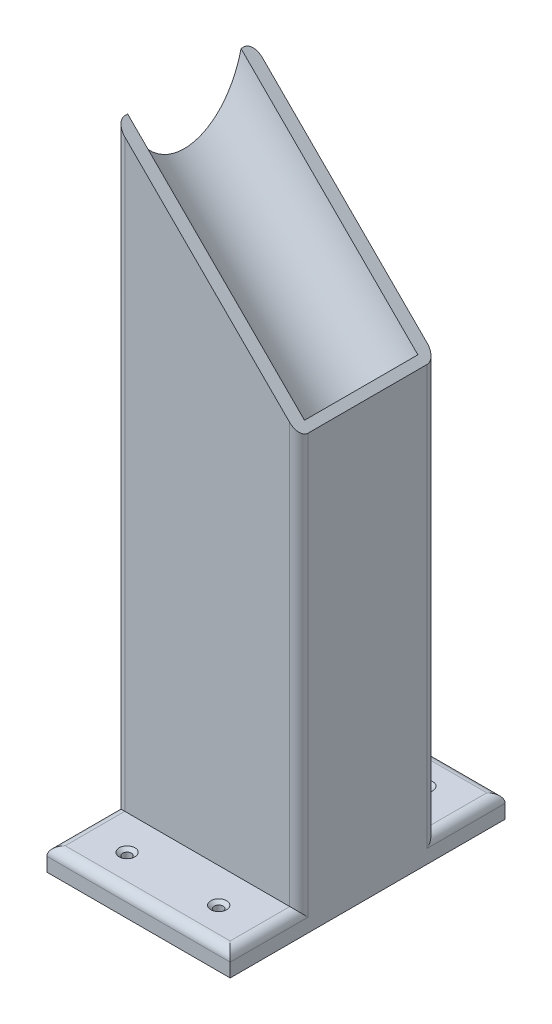
from build123d import *

# Parameters (mm, degrees)
SKETCH1_W                                         = 50.8
SKETCH1_H                                         = 76.2
BOSS_EXTRUDE1_DEPTH                               = 6.35
SKETCH2_W                                         = 50.8
SKETCH2_H                                         = 38.1
BOSS_EXTRUDE2_DEPTH                               = 171.6066
CUT_EXTRUDE1_DEPTH                                = 183.535025619
CUT_EXTRUDE1_DEPTH_BACK                           = 183.535025619
BOSS_EXTRUDE3_REACH                               = 237.296
SKETCH20_W                                        = 38.1
SKETCH20_H                                        = 2.54
BOSS_EXTRUDE4_REACH                               = 129.523
CSK_FOR_2_FLAT_HEAD_MACHINE_SCREW_100_D           = 2.4384
CSK_FOR_2_FLAT_HEAD_MACHINE_SCREW_100_CSINK_D     = 4.3688
CSK_FOR_2_FLAT_HEAD_MACHINE_SCREW_100_CSINK_ANGLE = 100
FILLET1_R                                         = 2.54
FILLET2_R                                         = 2.54


with BuildPart() as part:
    # Sketch1 → Boss-Extrude1 (new body)
    with BuildSketch(Plane(origin=(0, 0, 0), x_dir=(1, 0, 0), z_dir=(0, 1, 0))):
        with Locations((-132.195454545, 0)):
            Rectangle(SKETCH1_W, SKETCH1_H)
    extrude(amount=BOSS_EXTRUDE1_DEPTH)

    # Sketch2 → Boss-Extrude2 (add)
    with BuildSketch(Plane(origin=(0, 6.35, 0), x_dir=(1, 0, 0), z_dir=(0, 1, 0))):
        with Locations((-132.195454545, 0)):
            Rectangle(SKETCH2_W, SKETCH2_H)
    extrude(amount=BOSS_EXTRUDE2_DEPTH)

    # Sketch19 → Cut-Extrude1 (cut, two sides: drawn at the far end of the back side and taken through both)
    with BuildSketch(Plane(origin=(-167.776027273, 167.776027273, 0), x_dir=(-0.7071067811865488, -0.7071067811865462, 0), z_dir=(0.7071067811865462, -0.7071067811865488, 0)).offset(-CUT_EXTRUDE1_DEPTH_BACK)):
        with BuildLine():
            Line((-14.397504024, 16.51), (-14.397504024, -16.51))
            ThreePointArc((-14.397504024, -16.51), (2.112495976, 0), (-14.397504024, 16.51))
        make_face()
    extrude(amount=CUT_EXTRUDE1_DEPTH + CUT_EXTRUDE1_DEPTH_BACK, mode=Mode.SUBTRACT)

    # SurfaceCut1
    split(bisect_by=Plane(origin=(6.588470279, 6.588470279, 0), x_dir=(0, 0, 1), z_dir=(-0.7071067811865488, -0.7071067811865464, 0)), keep=Keep.TOP)

    # Sketch20 → Boss-Extrude3 (add, up to next)
    with BuildSketch(Plane(origin=(6.588470279, 6.588470279, 0), x_dir=(0, 0, -1), z_dir=(0.7071067811865487, 0.7071067811865465, 0)), mode=Mode.PRIVATE) as boss_extrude3_sk1:
        with Locations((0, 161.619084242)):
            Rectangle(SKETCH20_W, SKETCH20_H)
    boss_extrude3_tool1 = extrude(boss_extrude3_sk1.sketch, amount=-BOSS_EXTRUDE3_REACH, mode=Mode.PRIVATE) - part.part
    add(boss_extrude3_tool1.solids().sort_by_distance((-107.69348, 120.870421, 0))[0])

    # Boss-Extrude4: up to this face of the body (flat: up to its plane)
    boss_extrude4_end = Plane(part.part.faces().sort_by_distance((-106.795454545, 52.426789341, 0))[0])
    # Sketch22 → Boss-Extrude4 (add, up to the picked face)
    with BuildSketch(Plane(origin=(-113.383924824, 113.383924824, 0), x_dir=(0, 0, -1), z_dir=(0.7071067811865465, -0.7071067811865486, 0)), mode=Mode.PRIVATE) as boss_extrude4_sk1:
        with BuildLine():
            Line((-15.709032434, 9.317504024), (15.709032434, 9.317504024))
            ThreePointArc((15.709032434, 9.317504024), (0, -6.39152841), (-15.709032434, 9.317504024))
        make_face()
    boss_extrude4_tool1 = split(extrude(boss_extrude4_sk1.sketch, amount=BOSS_EXTRUDE4_REACH, mode=Mode.PRIVATE), bisect_by=boss_extrude4_end, keep=Keep.BOTH, mode=Mode.PRIVATE)
    add(boss_extrude4_tool1.solids().sort_by(Axis((-111.509821, 115.258029, 0), (0.7071067811865465, -0.7071067811865486, 0)))[0])

    # CSK for #2 Flat Head Machine Screw (100)1 (through all)
    with Locations(Plane(origin=(0, 6.35, 0), x_dir=(1, 0, 0), z_dir=(0, 1, 0))):
        with Locations((-144.895454545, -28.575), (-119.495454545, -28.575)):
            csk_for_2_flat_head_machine_screw_100 = CounterSinkHole(CSK_FOR_2_FLAT_HEAD_MACHINE_SCREW_100_D / 2, CSK_FOR_2_FLAT_HEAD_MACHINE_SCREW_100_CSINK_D / 2, counter_sink_angle=CSK_FOR_2_FLAT_HEAD_MACHINE_SCREW_100_CSINK_ANGLE)

    # Mirror1: CSK for #2 Flat Head Machine Screw (100)1 across plane
    add(csk_for_2_flat_head_machine_screw_100.mirror(Plane.XY), mode=Mode.SUBTRACT)

    # Fillet1
    fillet1_edges = [part.edges().sort_by_distance(p)[0] for p in [
        (-157.595454545, 88.561197552, 19.05),
        (-106.795454545, 63.161197552, 19.05),
        (-106.795454545, 63.161197552, -19.05),
        (-157.595454545, 88.561197552, -19.05),
    ]]
    fillet(fillet1_edges, radius=FILLET1_R)

    # Fillet2
    fillet2_edges = [part.edges().sort_by_distance(p)[0] for p in [
        (-157.595454545, 6.35, -27.305),
        (-132.195454545, 6.35, -38.1),
        (-106.795454545, 6.35, -27.305),
        (-157.595454545, 6.35, 27.305),
        (-132.195454545, 6.35, 38.1),
        (-106.795454545, 6.35, 27.305),
    ]]
    fillet(fillet2_edges, radius=FILLET2_R)


solid = part.part
